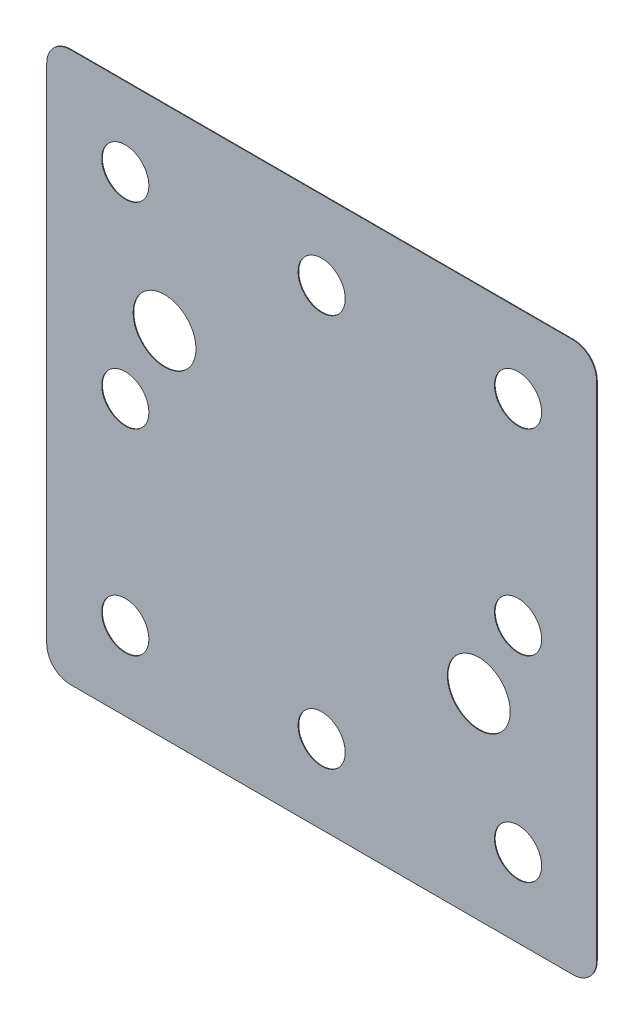
from build123d import *

# Parameters (mm, degrees)
SKETCH1_W           = 70
SKETCH1_H           = 70
BOSS_EXTRUDE1_DEPTH = 0.08
SKETCH2_R           = 3
CUT_EXTRUDE1_DEPTH  = 10
FILLET1_R           = 3
SKETCH3_R           = 4
CUT_EXTRUDE2_DEPTH  = 10


with BuildPart() as part:
    # Sketch1 → Boss-Extrude1 (new body)
    with BuildSketch(Plane.XY):
        Rectangle(SKETCH1_W, SKETCH1_H)
    extrude(amount=BOSS_EXTRUDE1_DEPTH)

    # Sketch2 → Cut-Extrude1 (cut)
    with BuildSketch(Plane.XY.offset(0.08)):
        with Locations((0, 25)):
            Circle(SKETCH2_R)
        with Locations((25, 25)):
            Circle(SKETCH2_R)
        with Locations((25, 0)):
            Circle(SKETCH2_R)
        with Locations((-25, 0)):
            Circle(SKETCH2_R)
        with Locations((-25, 25)):
            Circle(SKETCH2_R)
        with Locations((-25, -25)):
            Circle(SKETCH2_R)
        with Locations((0, -25)):
            Circle(SKETCH2_R)
        with Locations((25, -25)):
            Circle(SKETCH2_R)
    extrude(amount=-CUT_EXTRUDE1_DEPTH, mode=Mode.SUBTRACT)

    # Fillet1
    fillet1_edges = [part.edges().sort_by_distance(p)[0] for p in [
        (35, -35, 0.04),
        (-35, -35, 0.04),
        (-35, 35, 0.04),
        (35, 35, 0.04),
    ]]
    fillet(fillet1_edges, radius=FILLET1_R)

    # Sketch3 → Cut-Extrude2 (cut)
    with BuildSketch(Plane(origin=(0, 0, 0), x_dir=(-1, 0, 0), z_dir=(0, 0, -1))):
        with Locations((20, 10)):
            Circle(SKETCH3_R)
        with Locations((-20, -10)):
            Circle(SKETCH3_R)
    extrude(amount=-CUT_EXTRUDE2_DEPTH, mode=Mode.SUBTRACT)


solid = part.part
